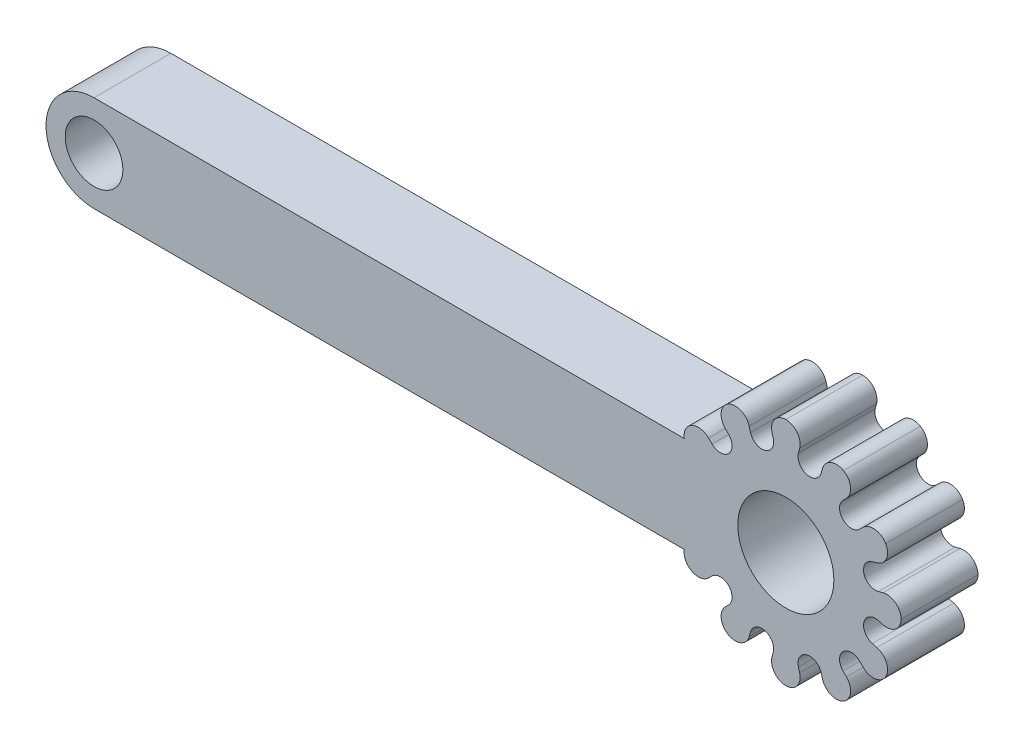
from build123d import *

# Parameters (mm, degrees)
SKETCH1_R           = 1.5
BOSS_EXTRUDE1_DEPTH = 4
CUT_EXTRUDE1_DEPTH  = 26.059928172
CIRPATTERN1_COUNT   = 12
SKETCH3_W           = 5.990659071
SKETCH3_H           = 5
BOSS_EXTRUDE2_DEPTH = 4
SKETCH4_R           = 2.5
CUT_EXTRUDE2_DEPTH  = 26.059928172


with BuildPart() as part:
    # Sketch1 → Boss-Extrude1 (new body)
    with BuildSketch(Plane.XY):
        with BuildLine():
            Line((-18, 2.5), (12.545643943, 2.5))
            ThreePointArc((12.545643943, 2.5), (24, 0), (12.545643943, -2.5))
            Line((12.545643943, -2.5), (-18, -2.5))
            ThreePointArc((-18, -2.5), (-20.5, 0), (-18, 2.5))
        make_face()
        with Locations((-18, 0)):
            Circle(SKETCH1_R, mode=Mode.SUBTRACT)
    extrude(amount=BOSS_EXTRUDE1_DEPTH)

    # Sketch2 → Cut-Extrude1 (cut, through all)
    with BuildSketch(Plane.XY.offset(4)):
        with BuildLine():
            ThreePointArc((21, 5.196152423), (19.633748274, 6.097231567), (18, 6))
            ThreePointArc((18, 6), (19.552914271, 5.795554958), (21, 5.196152423))
        make_face()
        with BuildLine():
            ThreePointArc((18, 6), (18.589879661, 5.706078038), (18.72, 5.06))
            Line((18.72, 5.06), (18.654523502, 4.81))
            ThreePointArc((18.654523502, 4.81), (19.09327028, 4.062778187), (19.840492093, 4.501524965))
            Line((19.840492093, 4.501524965), (19.906461709, 4.742088543))
            ThreePointArc((19.906461709, 4.742088543), (20.342188248, 5.236548367), (21, 5.196152423))
            ThreePointArc((21, 5.196152423), (19.552914271, 5.795554958), (18, 6))
        make_face()
    cut_extrude1 = extrude(amount=-CUT_EXTRUDE1_DEPTH, mode=Mode.SUBTRACT)

    # CirPattern1: Cut-Extrude1 ×12 about axis
    cirpattern1_axis = Axis((18, 0, 0), (0, 0, 1))
    for i in range(1, CIRPATTERN1_COUNT):
        add(cut_extrude1.rotate(cirpattern1_axis, i * 360 / CIRPATTERN1_COUNT), mode=Mode.SUBTRACT)

    # Sketch3 → Boss-Extrude2 (add)
    with BuildSketch(Plane.XY.offset(4)):
        with Locations((13.282390893, 0)):
            Rectangle(SKETCH3_W, SKETCH3_H)
    extrude(amount=-BOSS_EXTRUDE2_DEPTH)

    # Sketch4 → Cut-Extrude2 (cut, through all)
    with BuildSketch(Plane.XY.offset(4)):
        with Locations((18, 0)):
            Circle(SKETCH4_R)
    extrude(amount=-CUT_EXTRUDE2_DEPTH, mode=Mode.SUBTRACT)


solid = part.part
